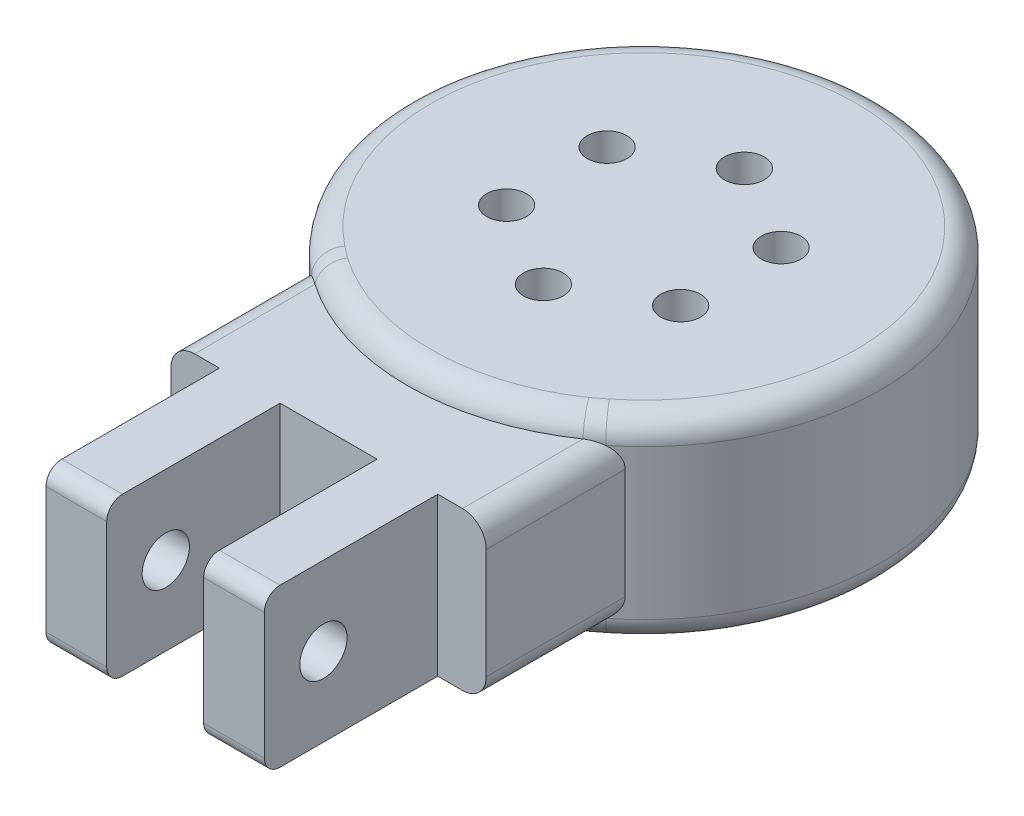
from build123d import *

# Parameters (mm, degrees)
SKETCH1_W               = 40
SKETCH1_H               = 20
BOSS_EXTRUDE1_DEPTH     = 10
FILLET1_R               = 3
SKETCH3_R               = 30
BOSS_EXTRUDE2_DEPTH     = 12.5
FILLET2_R               = 3
SKETCH5_R               = 2.524516272
CUT_EXTRUDE1_DEPTH      = 72.589105477
SKETCH6_W               = 7.7
SKETCH6_H               = 20
BOSS_EXTRUDE3_DEPTH     = 22
CUT_EXTRUDE3_DEPTH      = 76.359621305
CUT_EXTRUDE3_DEPTH_BACK = 76.359621305
SKETCH7_R               = 3
FILLET3_R               = 2


with BuildPart() as part:
    # Sketch1 → Boss-Extrude1 (new, symmetric)
    with BuildSketch(Plane(origin=(0, 0, 0), x_dir=(1, 0, 0), z_dir=(0, 1, 0))):
        Rectangle(SKETCH1_W, SKETCH1_H)
    extrude(amount=BOSS_EXTRUDE1_DEPTH, both=True)

    # Fillet1
    fillet1_edges = [part.edges().sort_by_distance(p)[0] for p in [
        (20, 10, 0),
        (-20, 10, 0),
        (20, -10, 0),
        (-20, -10, 0),
    ]]
    fillet(fillet1_edges, radius=FILLET1_R)

    # Sketch3 → Boss-Extrude2 (add, symmetric)
    with BuildSketch(Plane(origin=(0, 0, 0), x_dir=(1, 0, 0), z_dir=(0, 1, 0))):
        with Locations(Location((0, 30, 0), (0, 0, 270))):
            Circle(SKETCH3_R)
    extrude(amount=BOSS_EXTRUDE2_DEPTH, both=True)

    # Fillet2
    fillet2_edges = [part.edges().sort_by_distance(p)[0] for p in [
        (0, -12.5, -60),
        (0, 12.5, -60),
    ]]
    fillet(fillet2_edges, radius=FILLET2_R)

    # Sketch5 → Cut-Extrude1 (cut, through all)
    with BuildSketch(Plane(origin=(0, 12.5, 0), x_dir=(1, 0, 0), z_dir=(0, 1, 0))):
        with Locations(Location((0, 42.75, 0), (0, 0, 270))):
            Circle(SKETCH5_R)
        with Locations(Location((11.041823898, 36.375, 0), (0, 0, 270))):
            Circle(SKETCH5_R)
        with Locations(Location((11.041823898, 23.625, 0), (0, 0, 270))):
            Circle(SKETCH5_R)
        with Locations(Location((0, 17.25, 0), (0, 0, 270))):
            Circle(SKETCH5_R)
        with Locations(Location((-11.041823898, 23.625, 0), (0, 0, 270))):
            Circle(SKETCH5_R)
        with Locations(Location((-11.041823898, 36.375, 0), (0, 0, 270))):
            Circle(SKETCH5_R)
    extrude(amount=-CUT_EXTRUDE1_DEPTH, mode=Mode.SUBTRACT)

    # Sketch6 → Boss-Extrude3 (add)
    with BuildSketch(Plane.XY.offset(10)):
        with Locations((-10, 0)):
            Rectangle(SKETCH6_W, SKETCH6_H)
        with Locations((10, 0)):
            Rectangle(SKETCH6_W, SKETCH6_H)
    extrude(amount=BOSS_EXTRUDE3_DEPTH)

    # Sketch7 → Cut-Extrude3 (cut, two sides: drawn at the far end of the back side and taken through both)
    with BuildSketch(Plane.ZY.offset(13.85).offset(-CUT_EXTRUDE3_DEPTH_BACK)):
        with Locations(Location((24.5, 0, 0), (0, 0, 270))):
            Circle(SKETCH7_R)
    extrude(amount=CUT_EXTRUDE3_DEPTH + CUT_EXTRUDE3_DEPTH_BACK, mode=Mode.SUBTRACT)

    # Fillet3
    fillet3_edges = [part.edges().sort_by_distance(p)[0] for p in [
        (-10, 10, 32),
        (-10, -10, 32),
        (10, 10, 32),
        (10, -10, 32),
    ]]
    fillet(fillet3_edges, radius=FILLET3_R)


solid = part.part
